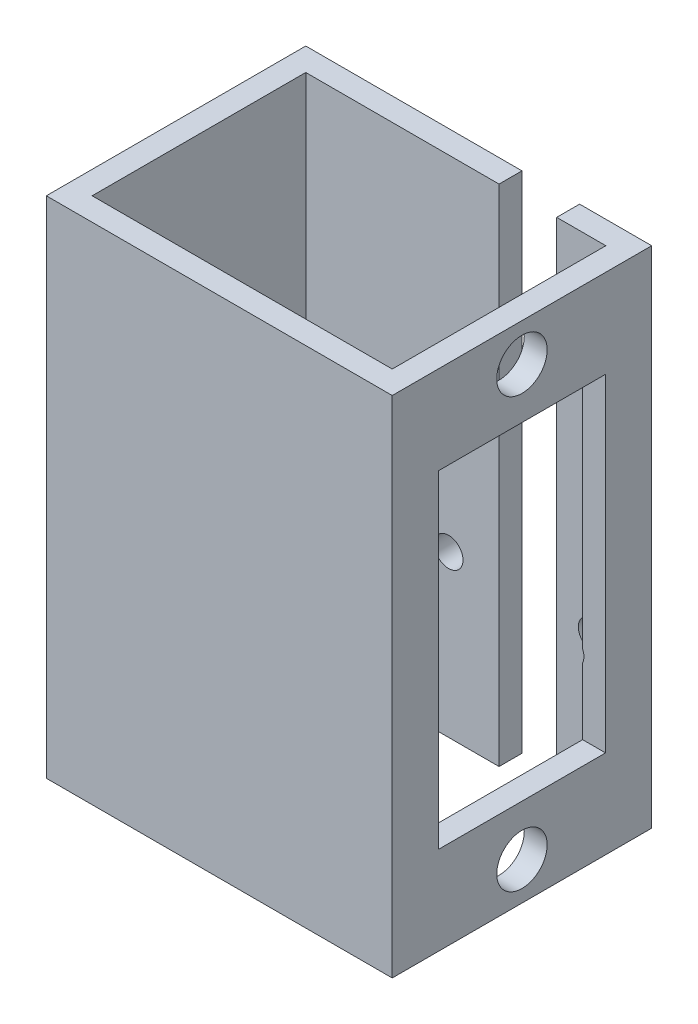
from build123d import *

# Parameters (mm, degrees)
BOSS_EXTRUDE1_DEPTH = 35
SKETCH2_R           = 1.75
SKETCH2_W           = 11.6
SKETCH2_H           = 22.75
CUT_EXTRUDE1_DEPTH  = 4
SKETCH3_R           = 1.25
CUT_EXTRUDE2_DEPTH  = 32
SKETCH4_R           = 1
CUT_EXTRUDE3_DEPTH  = 4


with BuildPart() as part:
    # Sketch1 → Boss-Extrude1 (new body)
    with BuildSketch(Plane(origin=(0, 0, 0), x_dir=(1, 0, 0), z_dir=(0, 1, 0))):
        Polygon((15, 0), (15, -1.59), (1.59, -1.59), (1.59, -16.41), (22.41, -16.41), (22.41, -1.59), (19, -1.59), (19, 0), (24, 0), (24, -18), (0, -18), (0, 0), align=None)
    extrude(amount=BOSS_EXTRUDE1_DEPTH)

    # Sketch2 → Cut-Extrude1 (cut)
    with BuildSketch(Plane(origin=(24, 0, 0), x_dir=(0, 0, -1), z_dir=(1, 0, 0))):
        with Locations((-9, 32.375)):
            Circle(SKETCH2_R)
        with Locations((-9, 2.625)):
            Circle(SKETCH2_R)
        with Locations((-9, 17.5)):
            Rectangle(SKETCH2_W, SKETCH2_H)
    extrude(amount=-CUT_EXTRUDE1_DEPTH, mode=Mode.SUBTRACT)

    # Sketch3 → Cut-Extrude2 (cut)
    with BuildSketch(Plane.ZY):
        with Locations((9, 11.15)):
            Circle(SKETCH3_R)
    extrude(amount=-CUT_EXTRUDE2_DEPTH, mode=Mode.SUBTRACT)

    # Sketch4 → Cut-Extrude3 (cut)
    with BuildSketch(Plane(origin=(0, 0, 0), x_dir=(-1, 0, 0), z_dir=(0, 0, -1))):
        with Locations((-11.5, 11.15)):
            Circle(SKETCH4_R)
        with Locations((-21.5, 11.15)):
            Circle(SKETCH4_R)
    extrude(amount=-CUT_EXTRUDE3_DEPTH, mode=Mode.SUBTRACT)


solid = part.part
